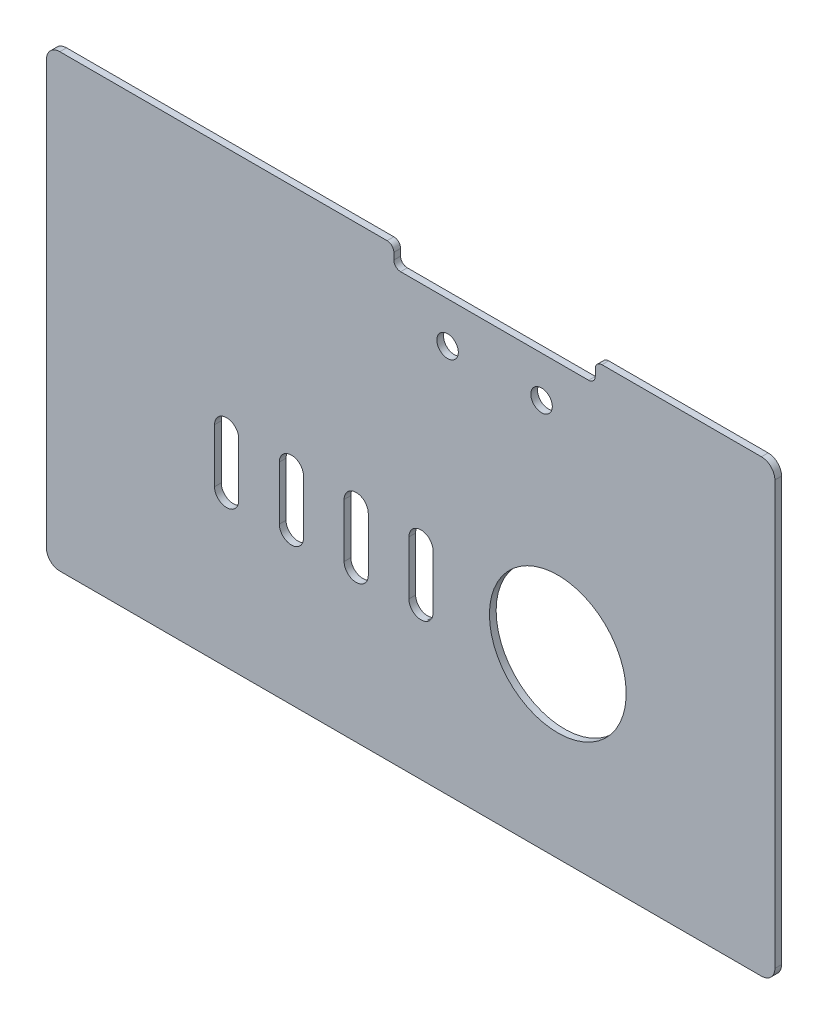
from build123d import *

# Parameters (mm, degrees)
SKETCH_1_W          = 127.5
SKETCH_1_H          = 70
SKETCH_1_R          = 1.6
EXTRUDE_1_DEPTH     = 1
SKETCH_2_W          = 127.5
SKETCH_2_H          = 3
CUT_EXTRUDE_1_DEPTH = 10
SKETCH_3_W          = 22
SKETCH_3_H          = 67
CUT_EXTRUDE_2_DEPTH = 10
SKETCH_4_W          = 3
SKETCH_4_H          = 67
EXTRUDE_3_DEPTH     = 1
SKETCH_5_W          = 30
SKETCH_5_H          = 6
CUT_EXTRUDE_3_DEPTH = 5
FILLET_1_R          = 1
FILLET_2_R          = 2
SKETCH_6_R          = 10.184947092
CUT_EXTRUDE_4_DEPTH = 5


with BuildPart() as part:
    # 草图1 → 凸台-拉伸1 (new body)
    with BuildSketch(Plane.XY):
        Rectangle(SKETCH_1_W, SKETCH_1_H)
        with Locations((-7, 22.9)):
            Circle(SKETCH_1_R, mode=Mode.SUBTRACT)
        with Locations((7, 22.9)):
            Circle(SKETCH_1_R, mode=Mode.SUBTRACT)
    extrude(amount=EXTRUDE_1_DEPTH)

    # 草图2 → 切除-拉伸1 (cut)
    with BuildSketch(Plane.XY.offset(1)):
        with Locations((0, 33.5)):
            Rectangle(SKETCH_2_W, SKETCH_2_H)
    extrude(amount=-CUT_EXTRUDE_1_DEPTH, mode=Mode.SUBTRACT)

    # 草图3 → 切除-拉伸2 (cut)
    with BuildSketch(Plane.XY.offset(1)):
        with Locations((52.75, -1.5)):
            Rectangle(SKETCH_3_W, SKETCH_3_H)
    extrude(amount=-CUT_EXTRUDE_2_DEPTH, mode=Mode.SUBTRACT)

    # 草图4 → 凸台-拉伸3 (add)
    with BuildSketch(Plane.XY.offset(1)):
        with Locations((-65.25, -1.5)):
            Rectangle(SKETCH_4_W, SKETCH_4_H)
    extrude(amount=-EXTRUDE_3_DEPTH)

    # 草图5 → 切除-拉伸3 (cut, symmetric)
    with BuildSketch(Plane.XY.offset(1)):
        with Locations((0, 32)):
            Rectangle(SKETCH_5_W, SKETCH_5_H)
    extrude(amount=CUT_EXTRUDE_3_DEPTH, both=True, mode=Mode.SUBTRACT)

    # 圆角1
    fillet_1_edges = [part.edges().sort_by_distance(p)[0] for p in [
        (-15, 32, 0.5),
        (15, 32, 0.5),
        (15, 29, 0.5),
        (-15, 29, 0.5),
    ]]
    fillet(fillet_1_edges, radius=FILLET_1_R)

    # 圆角2
    fillet_2_edges = [part.edges().sort_by_distance(p)[0] for p in [
        (41.75, 32, 0.5),
        (41.75, -35, 0.5),
        (-66.75, -35, 0.5),
        (-66.75, 32, 0.5),
    ]]
    fillet(fillet_2_edges, radius=FILLET_2_R)

    # 草图6 → 切除-拉伸4 (cut, symmetric)
    with BuildSketch(Plane(origin=(0, 0, 0), x_dir=(-1, 0, 0), z_dir=(0, 0, -1))):
        with Locations((-9.42, -8.6)):
            Circle(SKETCH_6_R)
        with BuildLine():
            Line((12.759998774, -12.590828373), (12.760187446, -4.590023504))
            add(Edge.make_bspline(
                [(12.760187446, -4.590023504), (12.76034149, -4.131184745), (12.371605061, -3.175167995), (10.96226041, -2.598669542), (9.551855004, -3.173570847), (9.161664376, -4.130045812), (9.161317678, -4.589244926)],
                knots=[0.000124436, 0.000124436, 0.000124436, 0.000124436, 0.250093327, 0.500062218, 0.750031109, 1, 1, 1, 1], degree=3))
            Line((9.161317678, -4.589244926), (9.160940723, -12.589969013))
            add(Edge.make_bspline(
                [(9.160940723, -12.589969013), (9.16093388, -13.04878603), (9.54993428, -14.004593398), (10.95932287, -14.580864951), (12.369900224, -14.00523711), (12.759249328, -13.049723173), (12.759998774, -12.590828373)],
                knots=[-6.415e-06, -6.415e-06, -6.415e-06, -6.415e-06, 0.250075228, 0.50015687, 0.750238513, 1.000320156, 1.000320156, 1.000320156, 1.000320156], degree=3))
        make_face()
        with BuildLine():
            Line((22.409427896, -12.590000012), (22.409427896, -4.589999921))
            ThreePointArc((22.409427896, -4.589999921), (20.60943071, -2.790002734), (18.809433524, -4.589999921))
            Line((18.809433524, -4.589999921), (18.809433524, -12.590000012))
            ThreePointArc((18.809433524, -12.590000012), (20.60943071, -14.389997198), (22.409427896, -12.590000012))
        make_face()
        with BuildLine():
            Line((32.059432501, -12.590000012), (32.059432501, -4.589999921))
            ThreePointArc((32.059432501, -4.589999921), (30.259435314, -2.790002734), (28.459438128, -4.589999921))
            Line((28.459438128, -4.589999921), (28.459438128, -12.590000012))
            ThreePointArc((28.459438128, -12.590000012), (30.259435314, -14.389997198), (32.059432501, -12.590000012))
        make_face()
        with BuildLine():
            Line((41.709430966, -12.590000012), (41.709430966, -4.589999921))
            ThreePointArc((41.709430966, -4.589999921), (39.90943378, -2.790002734), (38.109436593, -4.589999921))
            Line((38.109436593, -4.589999921), (38.109436593, -12.590000012))
            ThreePointArc((38.109436593, -12.590000012), (39.90943378, -14.389997198), (41.709430966, -12.590000012))
        make_face()
    extrude(amount=CUT_EXTRUDE_4_DEPTH, both=True, mode=Mode.SUBTRACT)


solid = part.part
